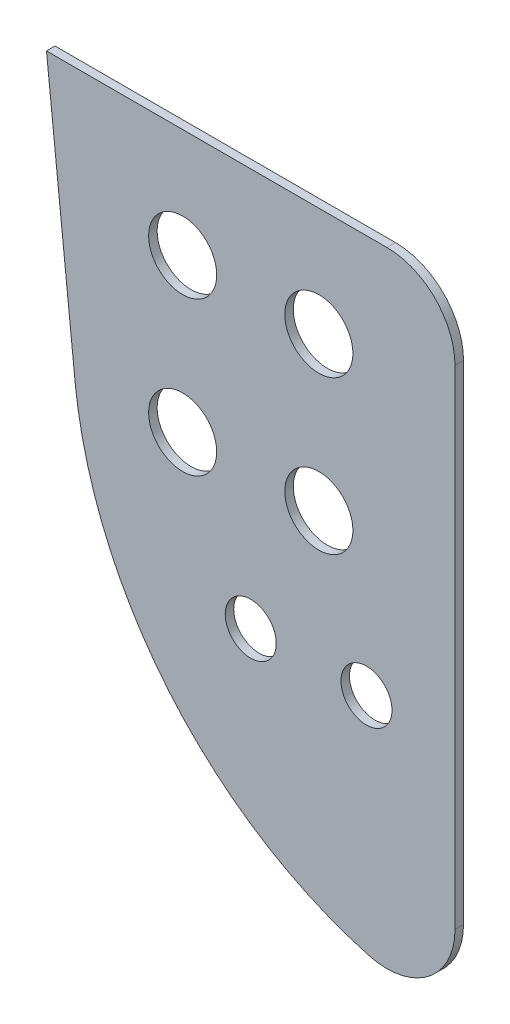
from build123d import *

# Parameters (mm, degrees)
BOSS_EXTRUDE1_DEPTH = 1.5875
SKETCH2_R           = 4.7625
SKETCH2_R_2         = 6.35
CUT_EXTRUDE1_DEPTH  = 206.048954313
FILLET1_R           = 12.7


with BuildPart() as part:
    # Sketch1 → Boss-Extrude1 (new body)
    with BuildSketch(Plane.XY):
        with BuildLine():
            Line((-55.575312576, -162.067948142), (-47.839788583, -163.268748691))
            Line((-47.839788583, -163.268748691), (-47.839788583, -44.216449654))
            Line((-47.839788583, -44.216449654), (-124.039788583, -44.216449654))
            Line((-124.039788583, -44.216449654), (-118.722269766, -94.836839988))
            add(Edge.make_bspline(
                [(-55.575312576, -162.067948142), (-55.59376342, -162.065079619), (-55.650171893, -162.056309885), (-55.85836741, -162.023649386), (-56.351423804, -161.94437151), (-57.298183962, -161.782953677), (-59.601702252, -161.351219818), (-62.636225688, -160.651117849), (-66.258238647, -159.610029405), (-69.466373553, -158.528422888), (-72.693657497, -157.269325681), (-75.860283712, -155.860035916), (-78.959504505, -154.303585309), (-81.9847211, -152.603319472), (-84.929496882, -150.762889625), (-87.787571241, -148.786244312), (-90.552872427, -146.677620258), (-93.219530166, -144.441532812), (-95.781887647, -142.082765831), (-98.23451307, -139.606361101), (-100.572210643, -137.017607297), (-102.790031074, -134.322028508), (-104.883281533, -131.525372358), (-106.847535073, -128.633597727), (-108.67863952, -125.652862104), (-110.372725796, -122.589508584), (-111.926215689, -119.450052525), (-113.33582904, -116.24116789), (-114.598590351, -112.969673286), (-115.711834779, -109.642517734), (-116.673213527, -106.266766169), (-117.480698597, -102.849584725), (-118.13258691, -99.398225801), (-118.490033874, -96.886133888), (-118.655606827, -95.451511305), (-118.689766491, -95.14113961), (-118.706492882, -94.98591445), (-118.715898664, -94.897412794), (-118.721125626, -94.847717815), (-118.722269766, -94.836839988)],
                knots=[0, 0, 0, 0, 0.000570634, 0.001744558, 0.006440232, 0.015831442, 0.031091736, 0.078042667, 0.110904268, 0.146108785, 0.181308268, 0.216502219, 0.251690199, 0.286871835, 0.322046819, 0.357214911, 0.392375937, 0.427529794, 0.462676442, 0.497815906, 0.532948271, 0.568073682, 0.603192339, 0.638304491, 0.673410436, 0.708510515, 0.743605108, 0.77869463, 0.813779526, 0.84886027, 0.88393736, 0.919011312, 0.954082662, 0.989151956, 0.994996677, 0.997334555, 0.998503491, 0.999672426, 1, 1, 1, 1], degree=3))
        make_face()
    extrude(amount=BOSS_EXTRUDE1_DEPTH)

    # Sketch2 → Cut-Extrude1 (cut, through all)
    with BuildSketch(Plane(origin=(0, 0, 0), x_dir=(-1, 0, 0), z_dir=(0, 0, -1))):
        with Locations((64.349788583, -118.511449654)):
            Circle(SKETCH2_R)
        with Locations((85.939788583, -118.511449654)):
            Circle(SKETCH2_R)
        with Locations((73.239788583, -93.111449654)):
            Circle(SKETCH2_R_2)
        with Locations((98.639788583, -93.111449654)):
            Circle(SKETCH2_R_2)
        with Locations((98.639788583, -64.536449654)):
            Circle(SKETCH2_R_2)
        with Locations((73.239788583, -64.536449654)):
            Circle(SKETCH2_R_2)
    extrude(amount=-CUT_EXTRUDE1_DEPTH, mode=Mode.SUBTRACT)

    # Fillet1
    fillet1_edges = [part.edges().sort_by_distance(p)[0] for p in [
        (-47.839788583, -44.216449654, 0.79375),
        (-47.839788583, -163.268748691, 0.79375),
    ]]
    fillet(fillet1_edges, radius=FILLET1_R)


solid = part.part
